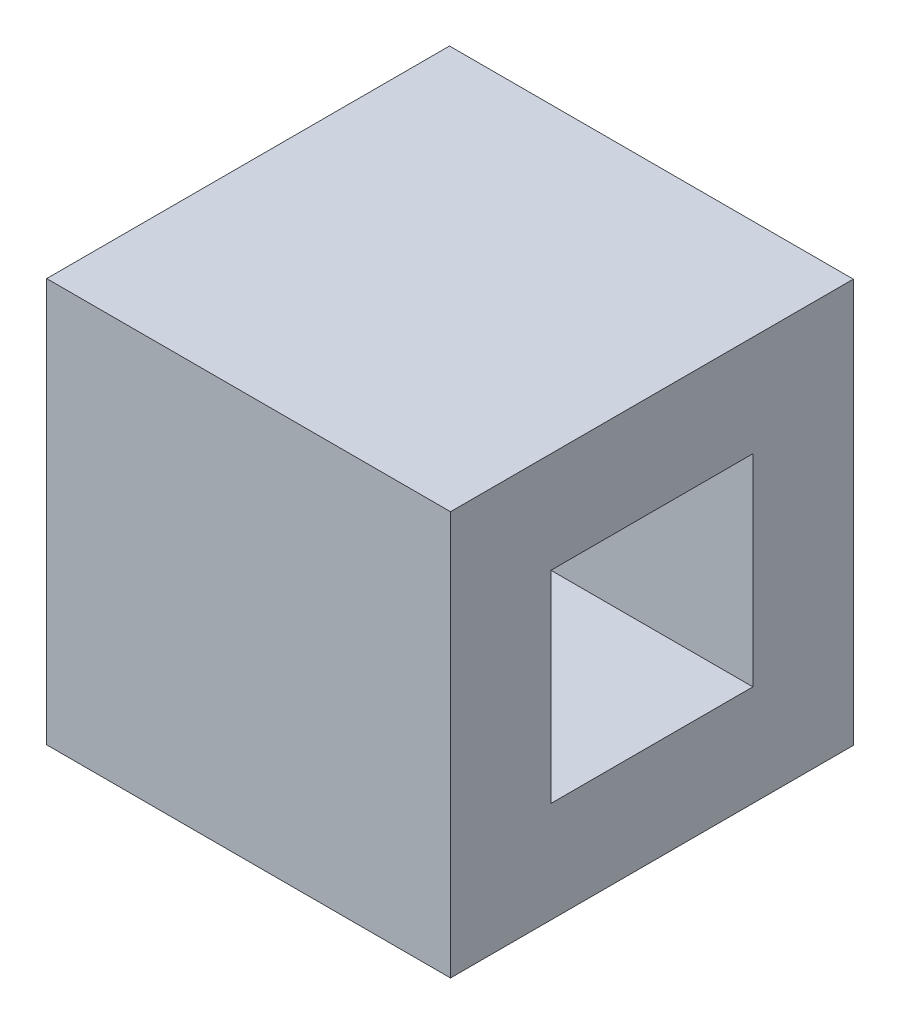
from build123d import *

# Parameters (mm, degrees)
SKETCH_1_W          = 40
SKETCH_1_H          = 39.9
EXTRUDE_1_DEPTH     = 40
SKETCH_3_W          = 20
SKETCH_3_H          = 20
CUT_EXTRUDE_1_DEPTH = 20


with BuildPart() as part:
    # 草图1 → 凸台-拉伸1 (new body)
    with BuildSketch(Plane(origin=(0, 0, 0), x_dir=(1, 0, 0), z_dir=(0, 1, 0))):
        with Locations((-20, 19.95)):
            Rectangle(SKETCH_1_W, SKETCH_1_H)
    extrude(amount=EXTRUDE_1_DEPTH)

    # 草图3 → 切除-拉伸1 (cut)
    with BuildSketch(Plane(origin=(0, 0, 0), x_dir=(0, 0, -1), z_dir=(1, 0, 0))):
        with Locations((19.95, 20)):
            Rectangle(SKETCH_3_W, SKETCH_3_H)
    extrude(amount=-CUT_EXTRUDE_1_DEPTH, mode=Mode.SUBTRACT)


solid = part.part
